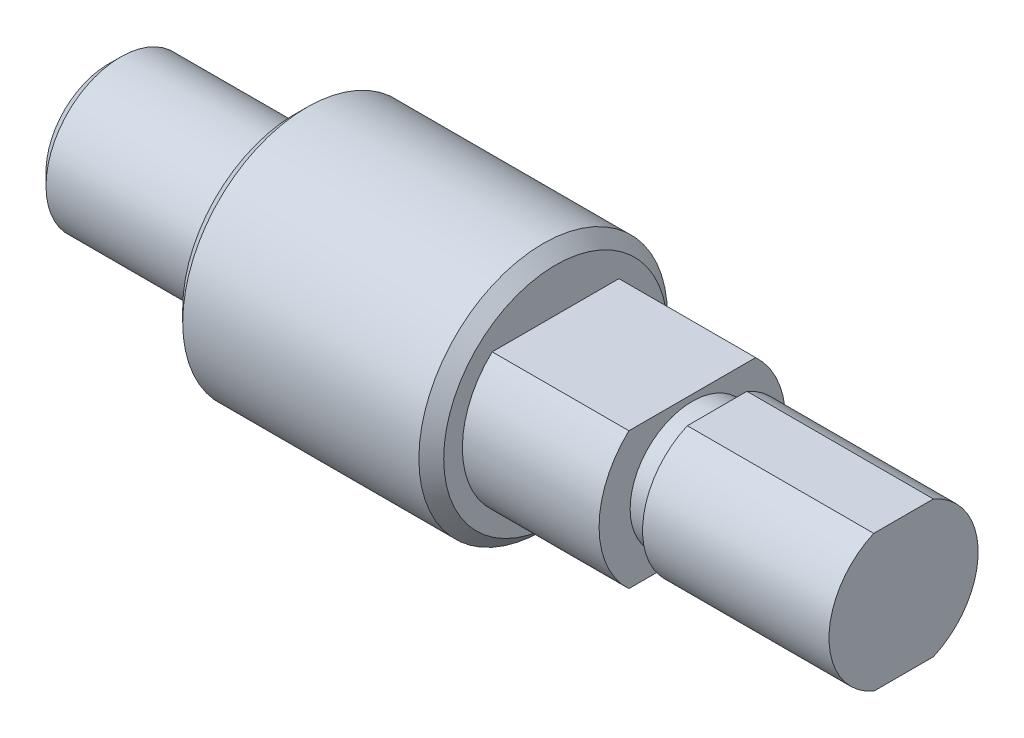
from build123d import *

# Parameters (mm, degrees)
CHAMFER_1_SIZE      = 1
SKETCH_6_W          = 32.162654491
SKETCH_6_H          = 6.23657893
SKETCH_6_H_2        = 6.236578929
CUT_EXTRUDE_1_DEPTH = 25


with BuildPart() as part:
    # 草图1 → 旋转6 (revolve)
    with BuildSketch(Plane.XY, mode=Mode.PRIVATE) as revolve_6_sk:
        Polygon((1183.122729102, 1053.377429506), (1198.122729102, 1053.377429506), (1198.122729102, 1056.377429506), (1199.122729102, 1057.377429506), (1218.122729102, 1057.377429506), (1219.122729102, 1056.377429506), (1219.122729102, 1054.877429506), (1230.122729102, 1054.877429506), (1230.122729102, 1052.377429506), (1232.122729102, 1052.377429506), (1232.122729102, 1053.377429506), (1247.122729102, 1053.377429506), (1247.122729102, 1047.377429506), (1199.835322309, 1047.377429506), (1196.062603927, 1049.877429506), (1183.122729102, 1049.877429506), align=None)
    revolve(revolve_6_sk.sketch.rotate(Axis((1180.708635967, 1047.377429506, 0), (1, 0, 0)), 90), axis=Axis((1180.708635967, 1047.377429506, 0), (1, 0, 0)))

    # 倒角1
    chamfer_1_edges = [part.edges().sort_by_distance(p)[0] for p in [
        (1183.122729102, 1047.377429506, -6),
    ]]
    chamfer(chamfer_1_edges, length=CHAMFER_1_SIZE)

    # 草图6 → 拉伸1 (cut, symmetric)
    with BuildSketch(Plane.XY):
        with Locations((1235.204056347, 1055.995718971)):
            Rectangle(SKETCH_6_W, SKETCH_6_H)
        with Locations((1235.204056347, 1038.759140041)):
            Rectangle(SKETCH_6_W, SKETCH_6_H_2)
    extrude(amount=CUT_EXTRUDE_1_DEPTH, both=True, mode=Mode.SUBTRACT)


solid = part.part
